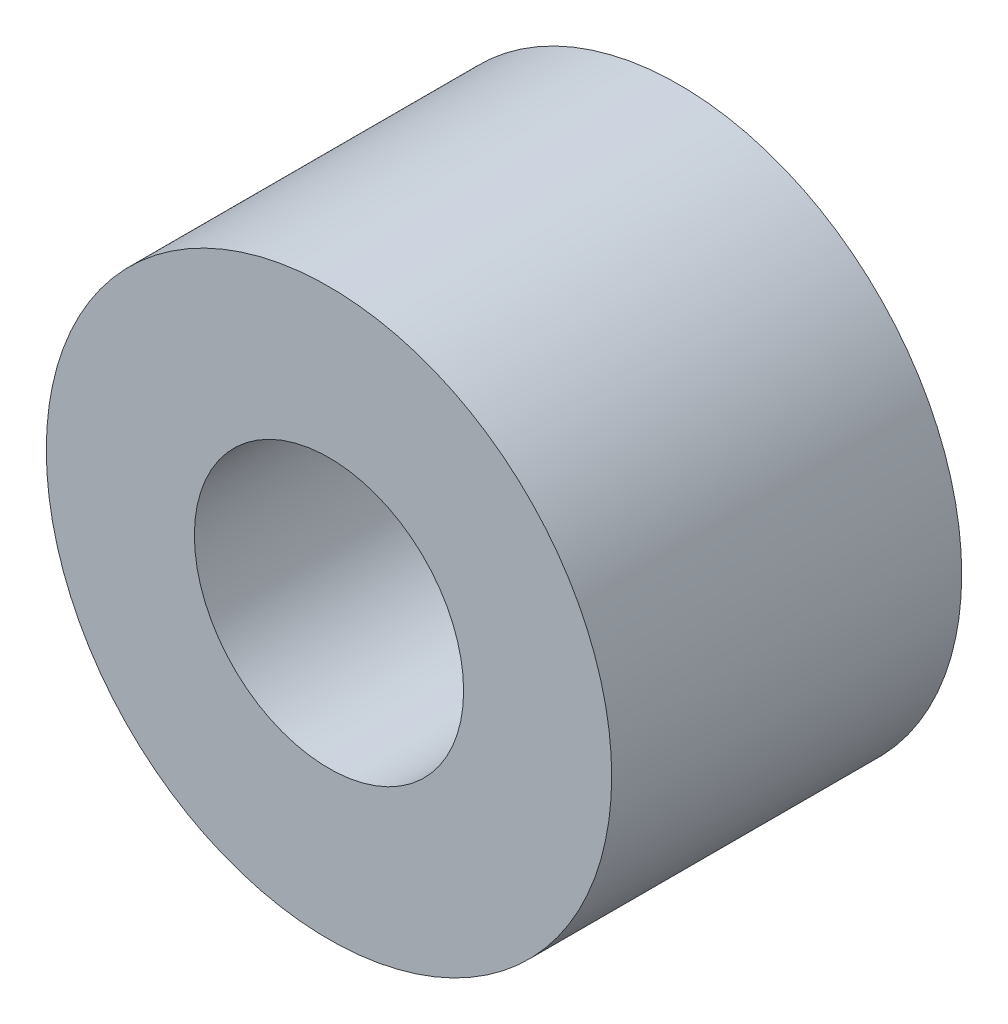
from build123d import *

# Parameters (mm, degrees)
SKETCH1_R           = 21
SKETCH1_R_2         = 10
BOSS_EXTRUDE1_DEPTH = 26


with BuildPart() as part:
    # Sketch1 → Boss-Extrude1 (new body)
    with BuildSketch(Plane.XY):
        with Locations(Location((0, 0, 0), (0, 0, 180))):
            Circle(SKETCH1_R)
        with Locations(Location((0, 0, 0), (0, 0, 180))):
            Circle(SKETCH1_R_2, mode=Mode.SUBTRACT)
    extrude(amount=BOSS_EXTRUDE1_DEPTH)


solid = part.part
